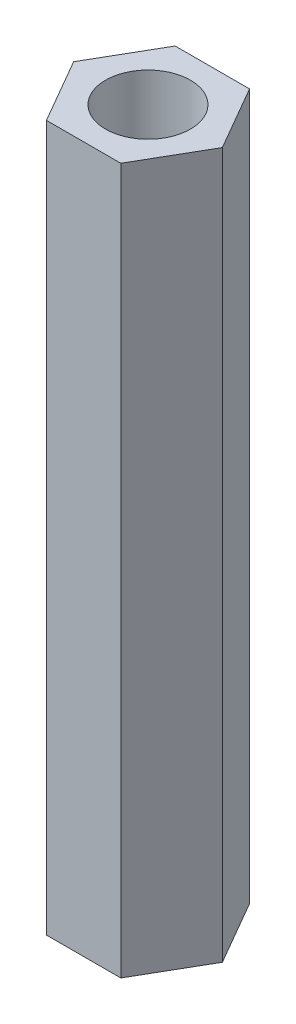
from build123d import *

# Parameters (mm, degrees)
SKETCH1_R           = 1.925
BOSS_EXTRUDE1_DEPTH = 32


with BuildPart() as part:
    # Sketch1 → Boss-Extrude1 (new body)
    with BuildSketch(Plane(origin=(0, 0, 0), x_dir=(1, 0, 0), z_dir=(0, 1, 0))):
        Polygon((-3.371725572, 0), (-1.685862786, -2.92), (1.685862786, -2.92), (3.371725572, 0), (1.685862786, 2.92), (-1.685862786, 2.92), align=None)
        with Locations(Location((0, 0, 0), (0, 0, 270))):
            Circle(SKETCH1_R, mode=Mode.SUBTRACT)
    extrude(amount=BOSS_EXTRUDE1_DEPTH)


solid = part.part
